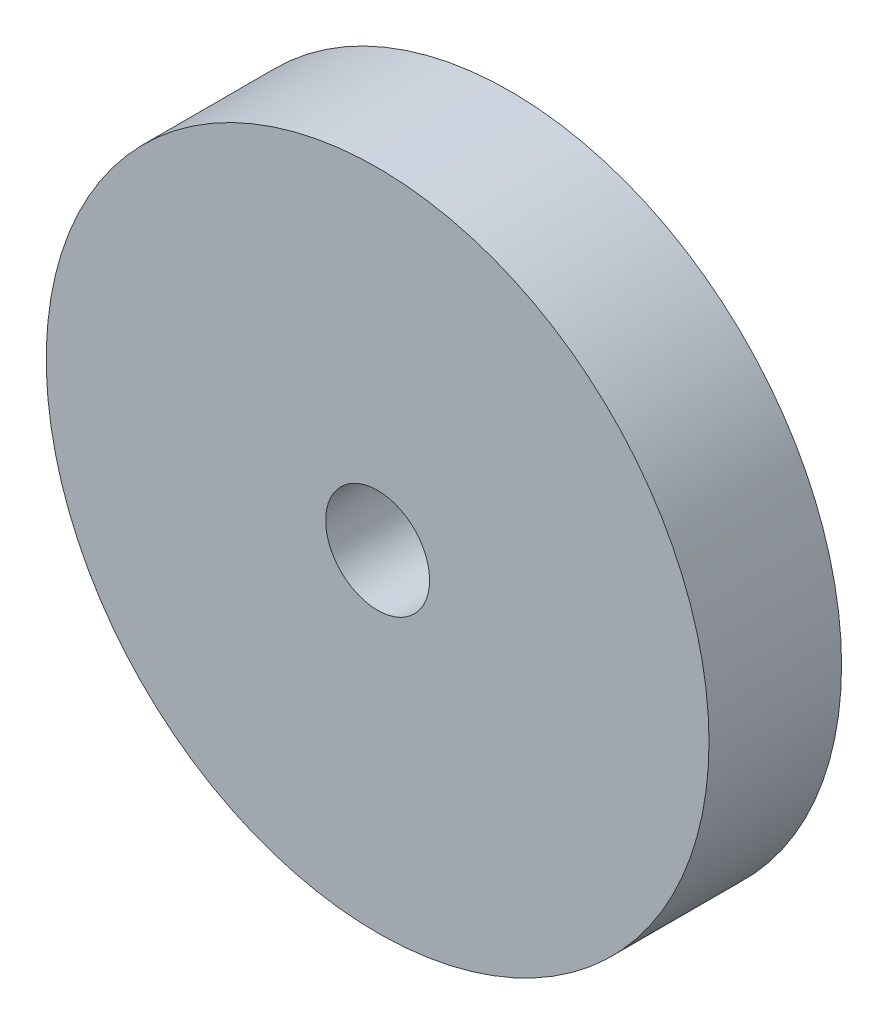
from build123d import *

# Parameters (mm, degrees)
SKETCH1_R           = 15.875
BOSS_EXTRUDE1_DEPTH = 6.35
SKETCH2_R           = 2.4892
CUT_EXTRUDE1_DEPTH  = 24.3313898


with BuildPart() as part:
    # Sketch1 → Boss-Extrude1 (new body)
    with BuildSketch(Plane.XY):
        Circle(SKETCH1_R)
    extrude(amount=BOSS_EXTRUDE1_DEPTH)

    # Sketch2 → Cut-Extrude1 (cut, through all)
    with BuildSketch(Plane.XY.offset(6.35)):
        Circle(SKETCH2_R)
    extrude(amount=-CUT_EXTRUDE1_DEPTH, mode=Mode.SUBTRACT)


solid = part.part
